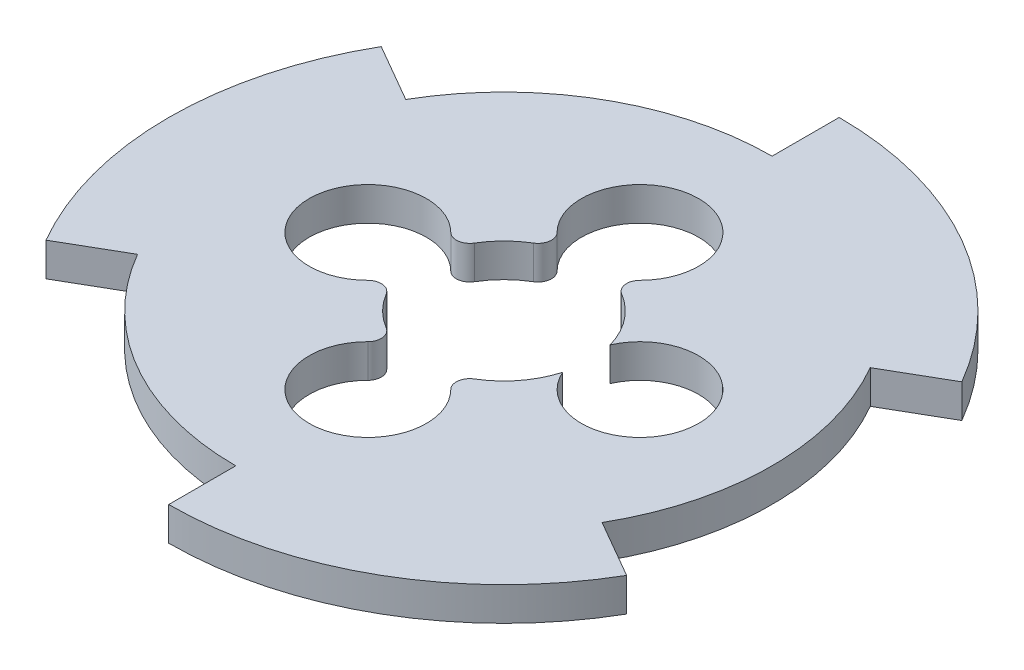
from build123d import *

# Parameters (mm, degrees)
BOSS_EXTRUDE1_DEPTH = 6.35
FILLET1_R           = 2.54


with BuildPart() as part:
    # Sketch1 → Boss-Extrude1 (new body)
    with BuildSketch(Plane(origin=(0, 0, 0), x_dir=(1, 0, 0), z_dir=(0, 1, 0))):
        with BuildLine():
            Line((0, 50.8), (0, 63.5))
            ThreePointArc((0, 63.5), (31.75, 54.99261314), (54.99261314, 31.75))
            Line((54.99261314, 31.75), (43.994090512, 25.4))
            ThreePointArc((43.994090512, 25.4), (50.8, 0), (43.994090512, -25.4))
            Line((43.994090512, -25.4), (54.99261314, -31.75))
            ThreePointArc((54.99261314, -31.75), (31.75, -54.99261314), (0, -63.5))
            Line((0, -63.5), (0, -50.8))
            ThreePointArc((0, -50.8), (-25.4, -43.994090512), (-43.994090512, -25.4))
            Line((-43.994090512, -25.4), (-54.99261314, -31.75))
            ThreePointArc((-54.99261314, -31.75), (-63.5, 0), (-54.99261314, 31.75))
            Line((-54.99261314, 31.75), (-43.994090512, 25.4))
            ThreePointArc((-43.994090512, 25.4), (-25.4, 43.994090512), (0, 50.8))
        make_face()
        with BuildLine():
            ThreePointArc((-4.50045673, 15.62060899), (-11.494727835, 11.494727835), (-15.62060899, 4.50045673))
            ThreePointArc((-15.62060899, 4.50045673), (-36.8935, 0), (-15.62060899, -4.50045673))
            ThreePointArc((-15.62060899, -4.50045673), (-11.494727835, -11.494727835), (-4.50045673, -15.62060899))
            ThreePointArc((-4.50045673, -15.62060899), (0, -36.8935), (4.50045673, -15.62060899))
            ThreePointArc((4.50045673, -15.62060899), (11.494727835, -11.494727835), (15.62060899, -4.50045673))
            ThreePointArc((15.62060899, -4.50045673), (36.8935, 0), (15.62060899, 4.50045673))
            ThreePointArc((15.62060899, 4.50045673), (11.494727835, 11.494727835), (4.50045673, 15.62060899))
            ThreePointArc((4.50045673, 15.62060899), (0, 36.8935), (-4.50045673, 15.62060899))
        make_face(mode=Mode.SUBTRACT)
    extrude(amount=BOSS_EXTRUDE1_DEPTH)

    # Fillet1
    fillet1_edges = [part.edges().sort_by_distance(p)[0] for p in [
        (4.50045673, 3.175, -15.62060899),
        (-4.50045673, 3.175, -15.62060899),
        (-15.62060899, 3.175, -4.50045673),
        (-15.62060899, 3.175, 4.50045673),
        (-4.50045673, 3.175, 15.62060899),
        (4.50045673, 3.175, 15.62060899),
    ]]
    fillet(fillet1_edges, radius=FILLET1_R)


solid = part.part
